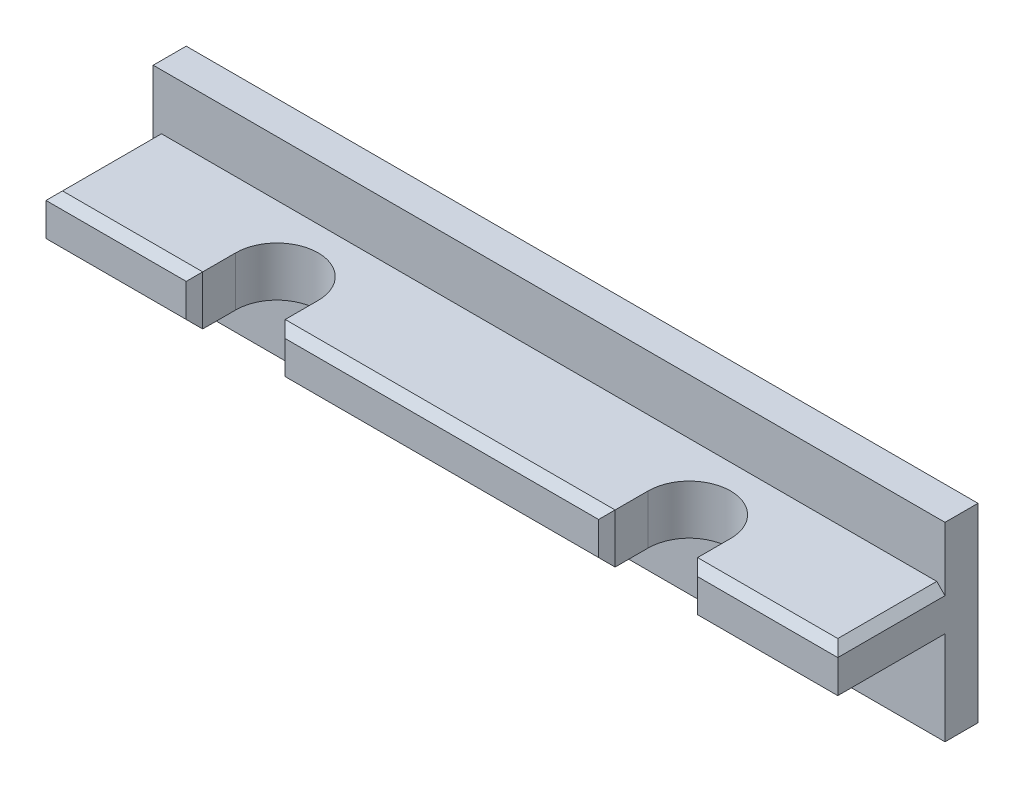
from build123d import *

# Parameters (mm, degrees)
SKETCH1_W           = 48
SKETCH1_H           = 11.525
BOSS_EXTRUDE1_DEPTH = 2
SKETCH1_3_W         = 48
SKETCH1_3_H         = 3
BOSS_EXTRUDE2_DEPTH = 8.5
CUT_EXTRUDE1_DEPTH  = 27.740991474
CHAMFER1_SIZE       = 0.5


with BuildPart() as part:
    # Sketch1 → Boss-Extrude1 (new body)
    with BuildSketch(Plane.XY):
        with Locations((0, 5.7625)):
            Rectangle(SKETCH1_W, SKETCH1_H)
    extrude(amount=BOSS_EXTRUDE1_DEPTH)

    # Sketch1<3> → Boss-Extrude2 (add)
    with BuildSketch(Plane.XY):
        with Locations((0, 6.675)):
            Rectangle(SKETCH1_3_W, SKETCH1_3_H)
    extrude(amount=BOSS_EXTRUDE2_DEPTH)

    # Sketch2 → Cut-Extrude1 (cut, through all)
    with BuildSketch(Plane(origin=(0, 8.175, 0), x_dir=(1, 0, 0), z_dir=(0, 1, 0))):
        with BuildLine():
            Line((-15, -6), (-15, -8.5))
            Line((-15, -8.5), (-10, -8.5))
            Line((-10, -8.5), (-10, -6))
            ThreePointArc((-10, -6), (-12.5, -3.5), (-15, -6))
        make_face()
        with BuildLine():
            Line((10, -8.5), (10, -6))
            ThreePointArc((10, -6), (12.5, -3.5), (15, -6))
            Line((15, -6), (15, -8.5))
            Line((15, -8.5), (10, -8.5))
        make_face()
    extrude(amount=-CUT_EXTRUDE1_DEPTH, mode=Mode.SUBTRACT)

    # Chamfer1
    chamfer1_edges = [part.edges().sort_by_distance(p)[0] for p in [
        (-24, 5.175, 5.25),
        (-19.5, 5.175, 8.5),
        (-15, 6.675, 8.5),
        (-24, 8.175, 5.25),
        (-19.5, 8.175, 8.5),
        (10, 6.675, 8.5),
        (0, 5.175, 8.5),
        (-10, 6.675, 8.5),
        (0, 8.175, 8.5),
        (24, 5.175, 5.25),
        (19.5, 5.175, 8.5),
        (15, 6.675, 8.5),
        (19.5, 8.175, 8.5),
        (24, 8.175, 5.25),
    ]]
    chamfer(chamfer1_edges, length=CHAMFER1_SIZE)


solid = part.part
